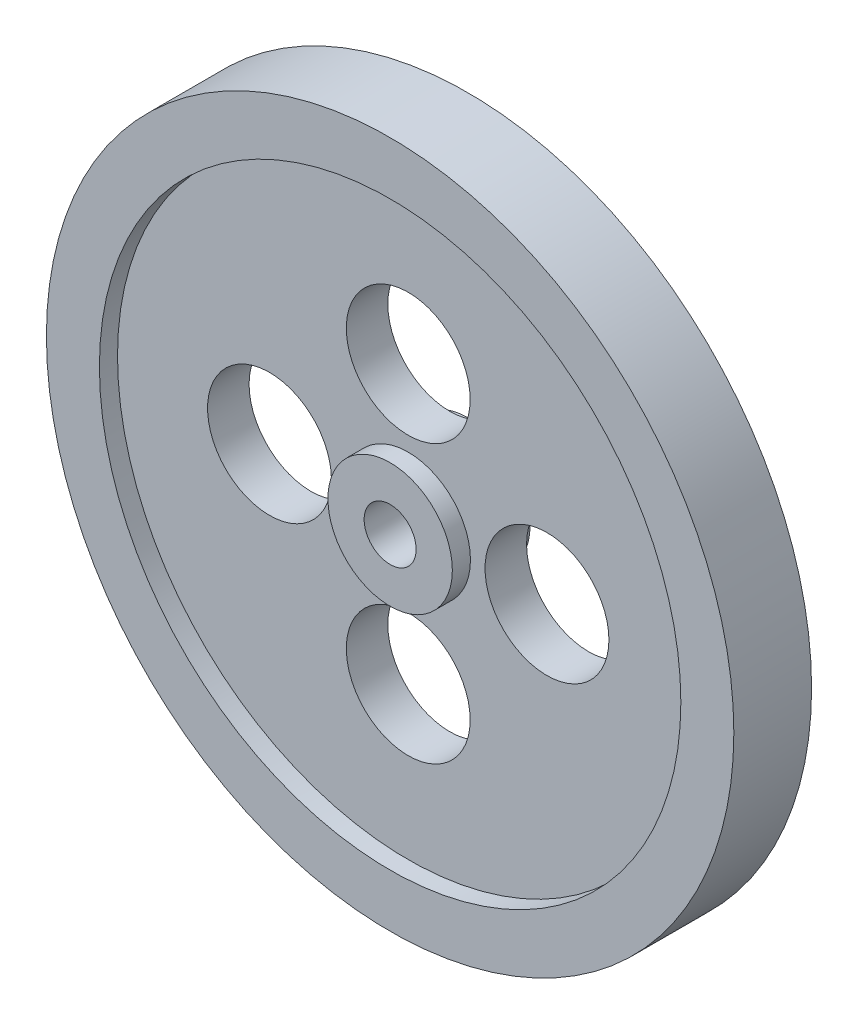
from build123d import *

# Parameters (mm, degrees)
SKETCH1_R           = 24.66826923
SKETCH1_R_2         = 1.8669
BOSS_EXTRUDE1_DEPTH = 2.79
SKETCH2_R           = 20.865
SKETCH2_R_2         = 4.465
CUT_EXTRUDE1_DEPTH  = 1.3
SKETCH3_R           = 4.445
CUT_EXTRUDE2_DEPTH  = 36.147765414


with BuildPart() as part:
    # Sketch1 → Boss-Extrude1 (new, symmetric)
    with BuildSketch(Plane.XY):
        Circle(SKETCH1_R)
        Circle(SKETCH1_R_2, mode=Mode.SUBTRACT)
    extrude(amount=BOSS_EXTRUDE1_DEPTH, both=True)

    # Sketch2 → Cut-Extrude1 (cut)
    with BuildSketch(Plane.XY.offset(2.79)):
        Circle(SKETCH2_R)
        Circle(SKETCH2_R_2, mode=Mode.SUBTRACT)
    cut_extrude1 = extrude(amount=-CUT_EXTRUDE1_DEPTH, mode=Mode.SUBTRACT)

    # Sketch3 → Cut-Extrude2 (cut, through all)
    with BuildSketch(Plane.XY.offset(1.49)):
        with Locations((0, 9.9568)):
            Circle(SKETCH3_R)
        with Locations((9.9568, 0)):
            Circle(SKETCH3_R)
        with Locations((0, -9.9568)):
            Circle(SKETCH3_R)
        with Locations((-9.9568, 0)):
            Circle(SKETCH3_R)
    extrude(amount=-CUT_EXTRUDE2_DEPTH, mode=Mode.SUBTRACT)

    # Mirror1: Cut-Extrude1 across plane
    add(cut_extrude1.mirror(Plane.XY), mode=Mode.SUBTRACT)


solid = part.part
